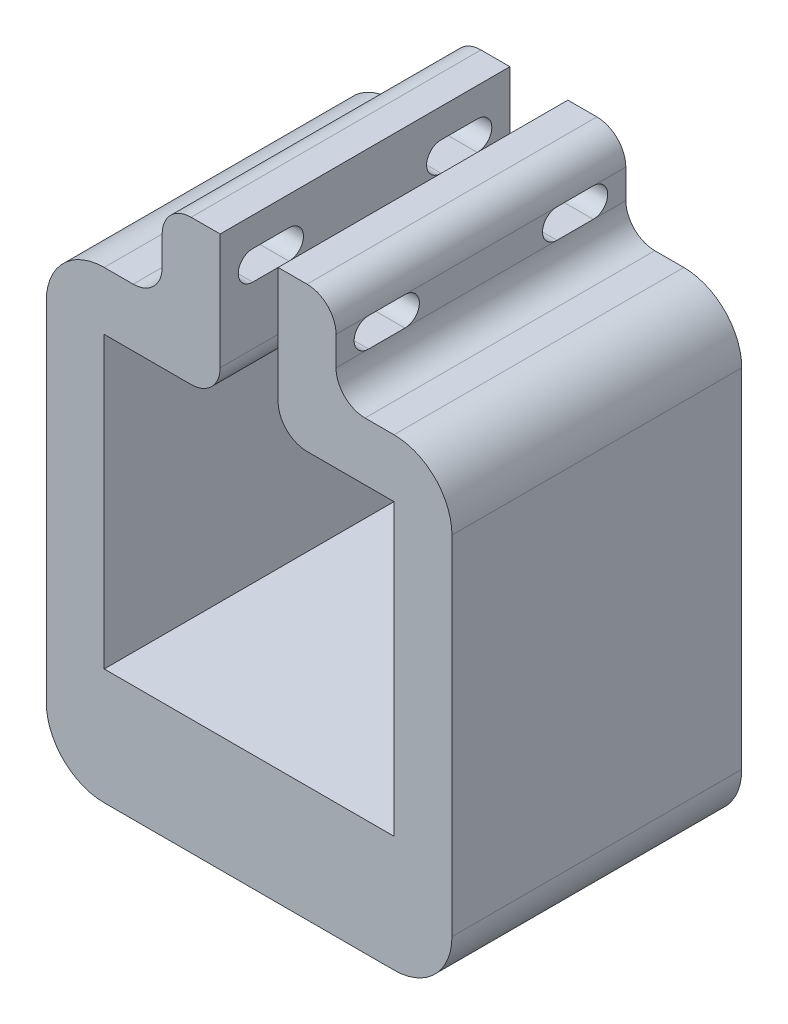
from build123d import *

# Parameters (mm, degrees)
SKETCH1_W                = 25.4
SKETCH1_H                = 25.4
BOSS_EXTRUDE1_DEPTH      = 25.4
SKETCH2_W                = 5.08
SKETCH2_H                = 5.08
CUT_EXTRUDE1_DEPTH       = 51.032197633
FILLET1_R                = 2.54
SKETCH3_W                = 5.08
SKETCH3_H                = 7.62
BOSS_EXTRUDE2_DEPTH      = 25.4
FILLET2_R                = 2.54
CUT_EXTRUDE2_DEPTH       = 53.363441445
BOSS_EXTRUDE3_DEPTH      = 5.08
BOSS_EXTRUDE3_DEPTH_BACK = 5.08
SKETCH5_W                = 35.56
SKETCH5_H                = 25.4
FILLET3_R                = 5.08


with BuildPart() as part:
    # Sketch1 → Boss-Extrude1 (new body)
    with BuildSketch(Plane.XY):
        with BuildLine():
            Line((-5.08, 0), (-5.08, 25.4))
            ThreePointArc((-5.08, 25.4), (-3.592102448, 28.992102448), (0, 30.48))
            Line((0, 30.48), (25.4, 30.48))
            ThreePointArc((25.4, 30.48), (28.992102448, 28.992102448), (30.48, 25.4))
            Line((30.48, 25.4), (30.48, 0))
            ThreePointArc((30.48, 0), (28.992102448, -3.592102448), (25.4, -5.08))
            Line((25.4, -5.08), (0, -5.08))
            ThreePointArc((0, -5.08), (-3.592102448, -3.592102448), (-5.08, 0))
        make_face()
        with Locations((12.7, 12.7)):
            Rectangle(SKETCH1_W, SKETCH1_H, mode=Mode.SUBTRACT)
    extrude(amount=BOSS_EXTRUDE1_DEPTH)

    # Sketch2 → Cut-Extrude1 (cut, through all)
    with BuildSketch(Plane.XY.offset(25.4)):
        with Locations((12.7, 27.94)):
            Rectangle(SKETCH2_W, SKETCH2_H)
    extrude(amount=-CUT_EXTRUDE1_DEPTH, mode=Mode.SUBTRACT)

    # Fillet1
    fillet1_edges = [part.edges().sort_by_distance(p)[0] for p in [
        (10.16, 25.4, 12.7),
        (15.24, 25.4, 12.7),
    ]]
    fillet(fillet1_edges, radius=FILLET1_R)

    # Sketch3 → Boss-Extrude2 (add)
    with BuildSketch(Plane.XY.offset(25.4)):
        with Locations((7.62, 34.29)):
            Rectangle(SKETCH3_W, SKETCH3_H)
        with Locations((17.78, 34.29)):
            Rectangle(SKETCH3_W, SKETCH3_H)
    extrude(amount=-BOSS_EXTRUDE2_DEPTH)

    # Fillet2
    fillet2_edges = [part.edges().sort_by_distance(p)[0] for p in [
        (5.08, 30.48, 12.7),
        (5.08, 38.1, 12.7),
        (20.32, 38.1, 12.7),
        (20.32, 30.48, 12.7),
    ]]
    fillet(fillet2_edges, radius=FILLET2_R)

    # Sketch4 → Cut-Extrude2 (cut, through all)
    with BuildSketch(Plane.ZY.offset(-5.08)):
        with BuildLine():
            Line((2.8575, 35.56), (6.0325, 35.56))
            ThreePointArc((6.0325, 35.56), (7.3025, 34.29), (6.0325, 33.02))
            Line((6.0325, 33.02), (2.8575, 33.02))
            ThreePointArc((2.8575, 33.02), (1.5875, 34.29), (2.8575, 35.56))
        make_face()
        with BuildLine():
            Line((19.3675, 35.56), (22.5425, 35.56))
            ThreePointArc((22.5425, 35.56), (23.8125, 34.29), (22.5425, 33.02))
            Line((22.5425, 33.02), (19.3675, 33.02))
            ThreePointArc((19.3675, 33.02), (18.0975, 34.29), (19.3675, 35.56))
        make_face()
    extrude(amount=-CUT_EXTRUDE2_DEPTH, mode=Mode.SUBTRACT)

    # Sketch5 → Boss-Extrude3 (add, two sides: drawn at the far end of the back side and taken through both)
    with BuildSketch(Plane.XZ.offset(5.08).offset(-BOSS_EXTRUDE3_DEPTH_BACK)):
        with Locations((12.7, 12.7)):
            Rectangle(SKETCH5_W, SKETCH5_H)
    extrude(amount=BOSS_EXTRUDE3_DEPTH + BOSS_EXTRUDE3_DEPTH_BACK)

    # Fillet3
    fillet3_edges = [part.edges().sort_by_distance(p)[0] for p in [
        (-5.08, -10.16, 12.7),
        (30.48, -10.16, 12.7),
    ]]
    fillet(fillet3_edges, radius=FILLET3_R)


solid = part.part
